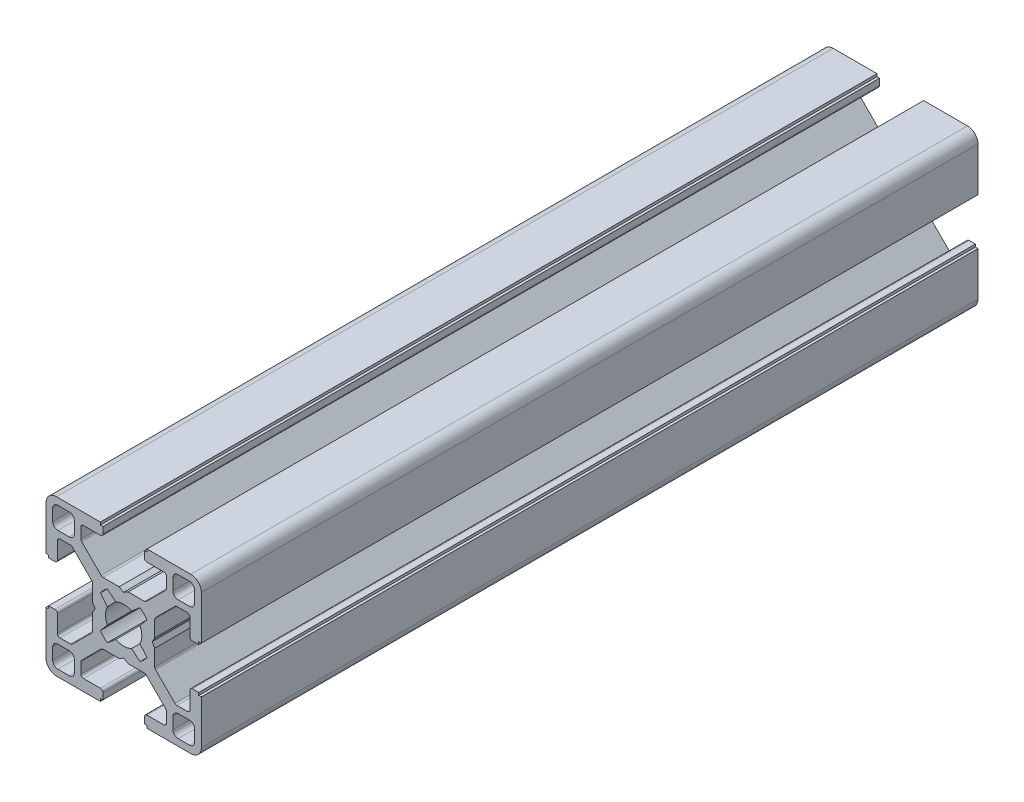
from build123d import *

# Parameters (mm, degrees)
BOSS_EXTRUDE1_DEPTH = 75
CIRPATTERN1_COUNT   = 4


with BuildPart() as part:
    # Sketch3 → Boss-Extrude1 (new, symmetric)
    with BuildSketch(Plane.XY):
        with BuildLine():
            Line((-4.503841895, 3.156803476), (-3.14772708, 1.530298739))
            ThreePointArc((-3.14772708, 1.530298739), (-3.410794979, 0.785160882), (-3.5, 0))
            Line((-3.5, 0), (-5.5, 0))
            Line((-5.5, 0), (-6, 0.866025404))
            Line((-6, 0.866025404), (-6, 3.996841995))
            ThreePointArc((-6, 3.996841995), (-6.038060234, 4.188183711), (-6.146446609, 4.350395385))
            Line((-6.146446609, 4.350395385), (-9.917104615, 8.121053391))
            ThreePointArc((-9.917104615, 8.121053391), (-10.079316289, 8.229439766), (-10.270658005, 8.2675))
            Line((-10.270658005, 8.2675), (-12.29, 8.2675))
            ThreePointArc((-12.29, 8.2675), (-12.643553391, 8.121053391), (-12.79, 7.7675))
            Line((-12.79, 7.7675), (-12.79, 4.5))
            ThreePointArc((-12.79, 4.5), (-12.936446609, 4.146446609), (-13.29, 4))
            Line((-13.29, 4), (-14.5, 4))
            Line((-14.5, 4), (-14.5, 4.5))
            Line((-14.5, 4.5), (-15, 4.5))
            Line((-15, 4.5), (-15, 12.968))
            ThreePointArc((-15, 12.968), (-14.404840979, 14.404840979), (-12.968, 15))
            Line((-12.968, 15), (-4.5, 15))
            Line((-4.5, 15), (-4.5, 14.5))
            Line((-4.5, 14.5), (-4, 14.5))
            Line((-4, 14.5), (-4, 13.29))
            ThreePointArc((-4, 13.29), (-4.146446609, 12.936446609), (-4.5, 12.79))
            Line((-4.5, 12.79), (-7.7675, 12.79))
            ThreePointArc((-7.7675, 12.79), (-8.121053391, 12.643553391), (-8.2675, 12.29))
            Line((-8.2675, 12.29), (-8.2675, 10.270658005))
            ThreePointArc((-8.2675, 10.270658005), (-8.229439766, 10.079316289), (-8.121053391, 9.917104615))
            Line((-8.121053391, 9.917104615), (-4.350395385, 6.146446609))
            ThreePointArc((-4.350395385, 6.146446609), (-4.188183711, 6.038060234), (-3.996841995, 6))
            Line((-3.996841995, 6), (-0.866025404, 6))
            Line((-0.866025404, 6), (0, 5.5))
            Line((0, 5.5), (0, 3.5))
            ThreePointArc((0, 3.5), (-0.785160882, 3.410794979), (-1.530298739, 3.14772708))
            Line((-1.530298739, 3.14772708), (-3.156803476, 4.503841895))
            ThreePointArc((-3.156803476, 4.503841895), (-3.889087297, 3.889087297), (-4.503841895, 3.156803476))
        make_face()
        with BuildLine():
            Line((-12.705, 9.5135), (-10.5135, 9.5135))
            ThreePointArc((-10.5135, 9.5135), (-9.806393219, 9.806393219), (-9.5135, 10.5135))
            Line((-9.5135, 10.5135), (-9.5135, 12.705))
            ThreePointArc((-9.5135, 12.705), (-9.806393219, 13.412106781), (-10.5135, 13.705))
            Line((-10.5135, 13.705), (-12.705, 13.705))
            ThreePointArc((-12.705, 13.705), (-13.412106781, 13.412106781), (-13.705, 12.705))
            Line((-13.705, 12.705), (-13.705, 10.5135))
            ThreePointArc((-13.705, 10.5135), (-13.412106781, 9.806393219), (-12.705, 9.5135))
        make_face(mode=Mode.SUBTRACT)
    boss_extrude1 = extrude(amount=BOSS_EXTRUDE1_DEPTH, both=True)

    # CirPattern1: Boss-Extrude1 ×4 about axis
    cirpattern1_axis = Axis((0, 0, 0), (0, 0, 1))
    for i in range(1, CIRPATTERN1_COUNT):
        add(boss_extrude1.rotate(cirpattern1_axis, i * 360 / CIRPATTERN1_COUNT))


solid = part.part
